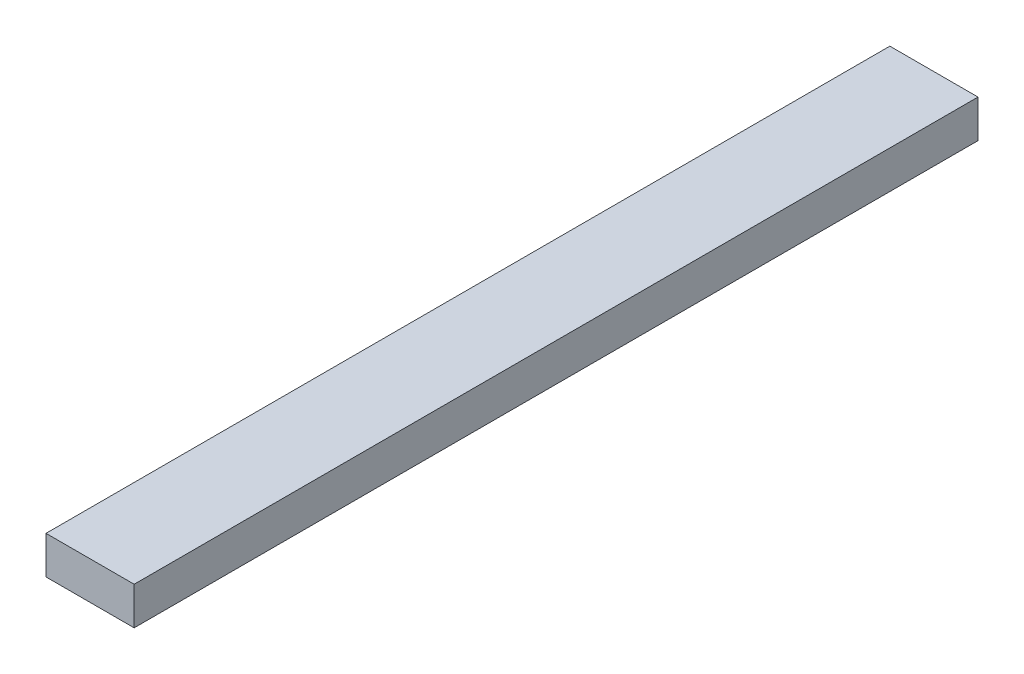
from build123d import *

# Parameters (mm, degrees)
SKETCH1_W           = 88.9
SKETCH1_H           = 38.1
BOSS_EXTRUDE1_DEPTH = 850.9


with BuildPart() as part:
    # Sketch1 → Boss-Extrude1 (new body)
    with BuildSketch(Plane.XY):
        with Locations((44.45, 19.05)):
            Rectangle(SKETCH1_W, SKETCH1_H)
    extrude(amount=BOSS_EXTRUDE1_DEPTH)


solid = part.part
